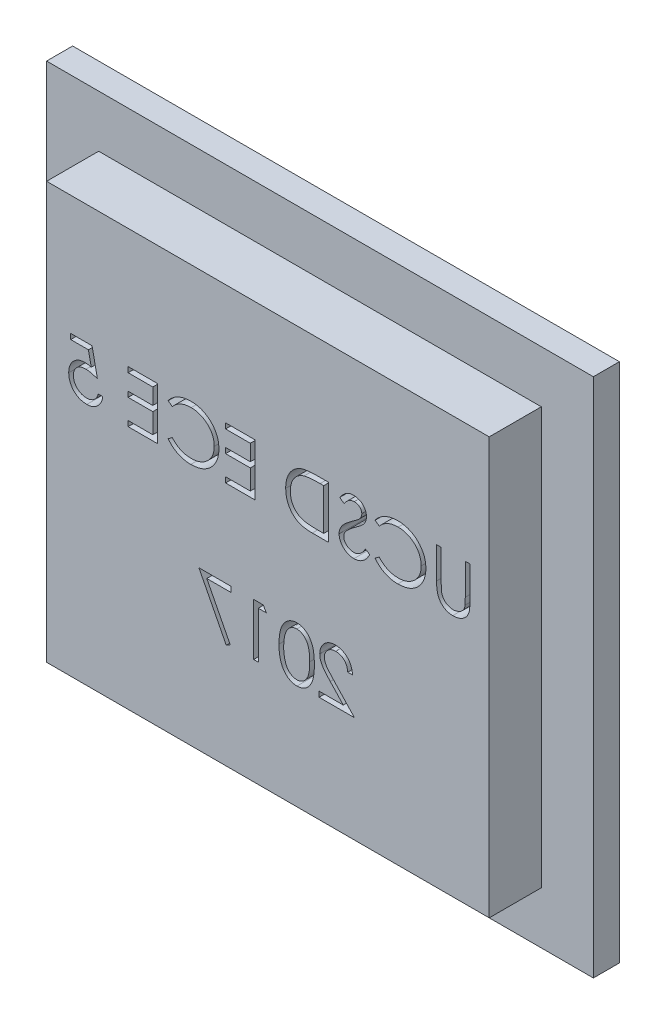
from build123d import *

# Parameters (mm, degrees)
SKETCH1_W               = 10.5
SKETCH1_H               = 10
BOSS_EXTRUDE1_DEPTH     = 0.5
SKETCH2_W               = 8.5
SKETCH2_H               = 8
BOSS_EXTRUDE2_DEPTH     = 1
CUT_EXTRUDE1_DEPTH      = 8.403546447
CUT_EXTRUDE1_DEPTH_BACK = 8.403546447


with BuildPart() as part:
    # Sketch1 → Boss-Extrude1 (new body)
    with BuildSketch(Plane.XY):
        Rectangle(SKETCH1_W, SKETCH1_H)
    extrude(amount=BOSS_EXTRUDE1_DEPTH)

    # Sketch2 → Boss-Extrude2 (add)
    with BuildSketch(Plane.XY.offset(0.5)):
        Rectangle(SKETCH2_W, SKETCH2_H)
    extrude(amount=BOSS_EXTRUDE2_DEPTH)

    # Sketch3 → Cut-Extrude1 (cut, two sides: drawn at the far end of the back side and taken through both)
    # profile 1 of 12: a face of its own
    with BuildSketch(Plane(origin=(0, 0, 0), x_dir=(-1, 0, 0), z_dir=(0, 0, -1)).offset(-CUT_EXTRUDE1_DEPTH_BACK)):
        with BuildLine():
            Line((-3.879763508, 1.701817293), (-3.790019919, 1.701817293))
            Line((-3.790019919, 1.701817293), (-3.790019919, 1.102658639))
            add(Edge.make_bspline(
                [(-3.790019919, 1.102658639), (-3.790033274, 1.094178429), (-3.790058618, 1.078085769), (-3.789889329, 1.05518054), (-3.789415223, 1.03481698), (-3.789116321, 1.016916595), (-3.788451368, 1.001561524), (-3.787909069, 0.988668578), (-3.787211767, 0.978298806), (-3.786373734, 0.972247113), (-3.786013508, 0.969645819)],
                knots=[0, 0, 0, 0, 1.528628734, 2.90083645, 4.128790002, 5.200304208, 6.127813768, 6.898992206, 7.526736466, 8, 8, 8, 8], degree=3))
            add(Edge.make_bspline(
                [(-3.786013508, 0.969645819), (-3.784534234, 0.960261029), (-3.781659038, 0.942020249), (-3.774331502, 0.916046454), (-3.76409793, 0.892637466), (-3.751971347, 0.871062812), (-3.7359906, 0.851922995), (-3.716846733, 0.834291094), (-3.693653085, 0.818870578), (-3.667864341, 0.804770346), (-3.640068558, 0.793437466), (-3.611665339, 0.784867933), (-3.583081631, 0.77964539), (-3.563945584, 0.779040665), (-3.554442996, 0.77874037)],
                knots=[0, 0, 0, 0, 1.035780045, 2.013197591, 2.933192213, 3.817615948, 4.702609284, 5.640816605, 6.646850145, 7.73207398, 8.84249596, 9.914020372, 10.964143139, 12, 12, 12, 12], degree=3))
            add(Edge.make_bspline(
                [(-3.554442996, 0.77874037), (-3.546284784, 0.779047184), (-3.530015481, 0.779659041), (-3.505842215, 0.783448021), (-3.482299327, 0.790276754), (-3.459270561, 0.799088114), (-3.437684565, 0.810730283), (-3.417529296, 0.824179094), (-3.399539601, 0.83995363), (-3.38312303, 0.857410871), (-3.368827334, 0.877107957), (-3.356435579, 0.898615996), (-3.346285314, 0.922258667), (-3.341272878, 0.938874216), (-3.338697803, 0.947410242)],
                knots=[0, 0, 0, 0, 0.994687771, 1.983630487, 2.973142513, 3.978332533, 4.983357753, 5.956394766, 6.925816176, 7.893390482, 8.871859704, 9.88551698, 10.913711441, 12, 12, 12, 12], degree=3))
            add(Edge.make_bspline(
                [(-3.338697803, 0.947410242), (-3.337840625, 0.950938406), (-3.335930485, 0.958800577), (-3.334145615, 0.972092374), (-3.332286608, 0.98777505), (-3.330996731, 1.005961282), (-3.329739239, 1.026590131), (-3.328986933, 1.049769062), (-3.328639209, 1.075413908), (-3.328535586, 1.09331024), (-3.328481457, 1.102658639)],
                knots=[0, 0, 0, 0, 0.558680831, 1.244966039, 2.062412453, 2.990489873, 4.051219941, 5.244515665, 6.560634259, 8, 8, 8, 8], degree=3))
            Line((-3.328481457, 1.102658639), (-3.328481457, 1.701817293))
            Line((-3.328481457, 1.701817293), (-3.238737867, 1.701817293))
            Line((-3.238737867, 1.701817293), (-3.238737867, 1.097850947))
            add(Edge.make_bspline(
                [(-3.238737867, 1.097850947), (-3.238810473, 1.086965696), (-3.238952168, 1.065722466), (-3.240180904, 1.034593507), (-3.242140047, 1.005064083), (-3.244908072, 0.977130227), (-3.248575787, 0.950891896), (-3.252654422, 0.926119105), (-3.257848574, 0.902989679), (-3.26391526, 0.881323273), (-3.270850559, 0.860698841), (-3.279833745, 0.841124951), (-3.28995503, 0.822006551), (-3.301959217, 0.803632806), (-3.315448183, 0.785922362), (-3.330720092, 0.768982626), (-3.347269852, 0.752542899), (-3.365372584, 0.73702488), (-3.384729877, 0.722793829), (-3.40528415, 0.710280181), (-3.426877513, 0.699702004), (-3.449453835, 0.690994597), (-3.47302275, 0.684447569), (-3.497584853, 0.679568953), (-3.523196051, 0.676796868), (-3.540614524, 0.676384888), (-3.549434983, 0.676176267)],
                knots=[0, 0, 0, 0, 1.316592851, 2.569410997, 3.76748051, 4.895814652, 5.963796859, 6.97159953, 7.931736103, 8.829262218, 9.692595152, 10.560224239, 11.431080259, 12.30701507, 13.211635791, 14.121146779, 15.063487852, 16.031507147, 17.00238618, 17.966455255, 18.938106653, 19.907068911, 20.888905087, 21.893141452, 22.933117798, 24, 24, 24, 24], degree=3))
            add(Edge.make_bspline(
                [(-3.549434983, 0.676176267), (-3.559054726, 0.676400486), (-3.577928629, 0.676840402), (-3.605739505, 0.679361188), (-3.632400704, 0.684109301), (-3.658193812, 0.690154999), (-3.682767668, 0.698493209), (-3.70645151, 0.708235531), (-3.728839704, 0.720200462), (-3.750295455, 0.73351286), (-3.770245385, 0.748491328), (-3.788558929, 0.764817092), (-3.805266321, 0.782228629), (-3.820085948, 0.800914447), (-3.833263344, 0.820729221), (-3.844614833, 0.841729004), (-3.854361475, 0.863905665), (-3.859391922, 0.879320866), (-3.861934983, 0.887113767)],
                knots=[0, 0, 0, 0, 1.13879206, 2.234305948, 3.301075583, 4.341971843, 5.366689343, 6.369221514, 7.369726634, 8.367512178, 9.355451585, 10.318319045, 11.268648973, 12.207971039, 13.137398894, 14.081662264, 15.030215811, 16, 16, 16, 16], degree=3))
            add(Edge.make_bspline(
                [(-3.861934983, 0.887113767), (-3.863414171, 0.89243736), (-3.866622563, 0.903984351), (-3.870058362, 0.923094776), (-3.872946671, 0.945099039), (-3.875662545, 0.969998644), (-3.877265104, 0.997812891), (-3.878670087, 1.028529725), (-3.879773406, 1.062186285), (-3.8797669, 1.085630432), (-3.879763508, 1.097850947)],
                knots=[0, 0, 0, 0, 0.625038921, 1.35572334, 2.194682327, 3.136881307, 4.189498639, 5.346923369, 6.617055217, 8, 8, 8, 8], degree=3))
            Line((-3.879763508, 1.097850947), (-3.879763508, 1.701817293))
        make_face()
    # profile 2 of 12: a face of its own
    with BuildSketch(Plane(origin=(0, 0, 0), x_dir=(-1, 0, 0), z_dir=(0, 0, -1)).offset(-CUT_EXTRUDE1_DEPTH_BACK)):
        with BuildLine():
            Line((-2.059250688, 1.518323703), (-2.137776329, 1.458227549))
            add(Edge.make_bspline(
                [(-2.137776329, 1.458227549), (-2.143378011, 1.464903541), (-2.154505853, 1.478165517), (-2.172408483, 1.496788244), (-2.191066095, 1.514235461), (-2.210471558, 1.530590284), (-2.230974164, 1.545280788), (-2.252077249, 1.559072532), (-2.274133833, 1.571434743), (-2.304634329, 1.586424168), (-2.344533714, 1.602065926), (-2.394760811, 1.615181135), (-2.447192553, 1.623530042), (-2.482963296, 1.624434283), (-2.501157739, 1.624894216)],
                knots=[0, 0, 0, 0, 0.757959112, 1.505699292, 2.245454638, 2.979532153, 3.711538275, 4.438200793, 5.171680507, 5.909471876, 7.393775596, 8.890124382, 10.418191784, 12, 12, 12, 12], degree=3))
            add(Edge.make_bspline(
                [(-2.501157739, 1.624894216), (-2.511181539, 1.624778798), (-2.531136108, 1.624549034), (-2.560749958, 1.621517855), (-2.58981083, 1.617257509), (-2.61829982, 1.610935988), (-2.646180665, 1.602943811), (-2.673635637, 1.593393693), (-2.700267237, 1.581578025), (-2.726443877, 1.568518522), (-2.751523651, 1.553767823), (-2.775253665, 1.537678294), (-2.79754737, 1.520429981), (-2.818422402, 1.501958236), (-2.837900102, 1.482346248), (-2.855839333, 1.461385007), (-2.872178022, 1.439141529), (-2.887240029, 1.415909127), (-2.900729381, 1.391755472), (-2.912023633, 1.366591166), (-2.922025096, 1.340847137), (-2.929939166, 1.314232519), (-2.936203313, 1.286934586), (-2.940525503, 1.258880075), (-2.943522209, 1.230127596), (-2.943750831, 1.210639221), (-2.943866073, 1.20081569)],
                knots=[0, 0, 0, 0, 1.054917814, 2.100044995, 3.131103042, 4.146048494, 5.169673617, 6.183595914, 7.203665975, 8.234915748, 9.262203917, 10.264457458, 11.251630812, 12.227803204, 13.197192746, 14.159520551, 15.12972552, 16.100847026, 17.073214652, 18.039054194, 19.002613845, 19.979014051, 20.95965708, 21.949030935, 22.966165397, 24, 24, 24, 24], degree=3))
            add(Edge.make_bspline(
                [(-2.943866073, 1.20081569), (-2.943505553, 1.186035313), (-2.94279772, 1.157016003), (-2.936498196, 1.114510115), (-2.926925313, 1.073789922), (-2.912578005, 1.035109967), (-2.894886848, 0.997993293), (-2.872532387, 0.963067907), (-2.846641948, 0.929806031), (-2.816849257, 0.89899376), (-2.784161881, 0.870846982), (-2.749091049, 0.846061101), (-2.71172411, 0.825399706), (-2.672473644, 0.808206579), (-2.631037611, 0.794990371), (-2.587490525, 0.785686335), (-2.541927098, 0.779617141), (-2.510792983, 0.779036087), (-2.494947803, 0.77874037)],
                knots=[0, 0, 0, 0, 1.029171465, 2.020641659, 2.987623507, 3.938342917, 4.889210282, 5.84687017, 6.821220943, 7.821438502, 8.827599549, 9.822697543, 10.807740252, 11.797342354, 12.80366471, 13.83203677, 14.896651826, 16, 16, 16, 16], degree=3))
            add(Edge.make_bspline(
                [(-2.494947803, 0.77874037), (-2.477489892, 0.779222878), (-2.443128547, 0.78017257), (-2.392737682, 0.78821807), (-2.344498892, 0.80126319), (-2.298409581, 0.819519739), (-2.254599683, 0.843252678), (-2.213000637, 0.8720235), (-2.173577331, 0.906105881), (-2.14987125, 0.932129632), (-2.137776329, 0.945407036)],
                knots=[0, 0, 0, 0, 1.028121516, 2.023589091, 2.998037872, 3.967518031, 4.937445131, 5.927275754, 6.942489185, 8, 8, 8, 8], degree=3))
            Line((-2.137776329, 0.945407036), (-2.059250688, 0.885911844))
            add(Edge.make_bspline(
                [(-2.059250688, 0.885911844), (-2.065570148, 0.877758001), (-2.078178798, 0.86148937), (-2.098595374, 0.838554596), (-2.120103173, 0.816982015), (-2.142861948, 0.796945551), (-2.166609888, 0.778044276), (-2.191773406, 0.760815181), (-2.218021701, 0.745017785), (-2.245265838, 0.73055295), (-2.27347687, 0.717719451), (-2.302620994, 0.70673266), (-2.332572587, 0.697268406), (-2.363333018, 0.689482138), (-2.394966092, 0.683404686), (-2.427357656, 0.679341921), (-2.46057762, 0.676558517), (-2.482989455, 0.676304827), (-2.494346842, 0.676176267)],
                knots=[0, 0, 0, 0, 0.986787822, 1.968848986, 2.935600012, 3.899624008, 4.868462664, 5.837806735, 6.815139263, 7.798259679, 8.787526145, 9.778297419, 10.776456485, 11.791383307, 12.812564526, 13.85620153, 14.913611965, 16, 16, 16, 16], degree=3))
            add(Edge.make_bspline(
                [(-2.494346842, 0.676176267), (-2.505102175, 0.676251122), (-2.526369515, 0.676399139), (-2.557769159, 0.678796901), (-2.58833761, 0.682068254), (-2.617987503, 0.686994006), (-2.646880639, 0.692806675), (-2.674755092, 0.700598462), (-2.701885152, 0.709326796), (-2.728161821, 0.719585363), (-2.753607449, 0.731161415), (-2.778139967, 0.744244718), (-2.80174809, 0.758725251), (-2.824663925, 0.774283825), (-2.846548949, 0.791420197), (-2.867592813, 0.809896378), (-2.887913521, 0.829650096), (-2.900485716, 0.843894339), (-2.906806778, 0.851056075)],
                knots=[0, 0, 0, 0, 1.114604814, 2.203992996, 3.262667896, 4.300477797, 5.318619304, 6.316056647, 7.298880507, 8.271930387, 9.238335007, 10.195173496, 11.151986948, 12.108099108, 13.064862484, 14.031167946, 15.010108607, 16, 16, 16, 16], degree=3))
            add(Edge.make_bspline(
                [(-2.906806778, 0.851056075), (-2.916931247, 0.863496415), (-2.937057955, 0.888226903), (-2.96280815, 0.928308612), (-2.984850309, 0.970156672), (-3.002672, 1.013990937), (-3.01660421, 1.059713048), (-3.02625598, 1.107346052), (-3.032527867, 1.156845464), (-3.033245092, 1.190513118), (-3.033609662, 1.207626588)],
                knots=[0, 0, 0, 0, 0.994628077, 1.977248131, 2.950237994, 3.925870899, 4.908910175, 5.911660606, 6.938484602, 8, 8, 8, 8], degree=3))
            add(Edge.make_bspline(
                [(-3.033609662, 1.207626588), (-3.033165321, 1.22561386), (-3.032291108, 1.261002696), (-3.024863738, 1.312938111), (-3.01291551, 1.362695654), (-2.995944971, 1.410182438), (-2.974429156, 1.455648232), (-2.947850124, 1.498745719), (-2.916516654, 1.539750519), (-2.880674492, 1.578040448), (-2.841369539, 1.613051692), (-2.79927845, 1.643853464), (-2.754483608, 1.66948704), (-2.707478507, 1.690914515), (-2.65791117, 1.707384362), (-2.60588735, 1.718913844), (-2.551504803, 1.726090163), (-2.514401253, 1.726997365), (-2.495548765, 1.727458319)],
                knots=[0, 0, 0, 0, 1.032925535, 2.032216505, 3.007276963, 3.968222605, 4.92396291, 5.891752235, 6.871517503, 7.883894988, 8.900124299, 9.891468569, 10.874487609, 11.85992873, 12.854644235, 13.869047385, 14.917252991, 16, 16, 16, 16], degree=3))
            add(Edge.make_bspline(
                [(-2.495548765, 1.727458319), (-2.484058916, 1.727320565), (-2.461315916, 1.727047895), (-2.427672301, 1.724388997), (-2.394917351, 1.719956538), (-2.363028499, 1.713923376), (-2.331850609, 1.706435569), (-2.301621968, 1.696681199), (-2.272165201, 1.685527904), (-2.243666084, 1.672682628), (-2.216261355, 1.658263559), (-2.18995955, 1.642430524), (-2.16496959, 1.625203151), (-2.141115634, 1.606727958), (-2.118796716, 1.586614084), (-2.097379151, 1.56541477), (-2.077590272, 1.542519392), (-2.065375073, 1.526403697), (-2.059250688, 1.518323703)],
                knots=[0, 0, 0, 0, 1.096760587, 2.17092713, 3.219439832, 4.250915756, 5.268269357, 6.278326846, 7.281116186, 8.274029601, 9.260640565, 10.235837813, 11.203064059, 12.156899882, 13.114053108, 14.069676657, 15.032185724, 16, 16, 16, 16], degree=3))
        make_face()
    # profile 3 of 12: a face of its own
    with BuildSketch(Plane(origin=(0, 0, 0), x_dir=(-1, 0, 0), z_dir=(0, 0, -1)).offset(-CUT_EXTRUDE1_DEPTH_BACK)):
        with BuildLine():
            Line((-1.956686585, 0.894725947), (-1.872151329, 0.945407036))
            add(Edge.make_bspline(
                [(-1.872151329, 0.945407036), (-1.864288975, 0.932245784), (-1.84922501, 0.907029331), (-1.82409605, 0.872955605), (-1.798058075, 0.843994989), (-1.770918266, 0.820315958), (-1.74284228, 0.801673419), (-1.713646836, 0.788472782), (-1.683430319, 0.780239646), (-1.66286637, 0.779239621), (-1.652600047, 0.77874037)],
                knots=[0, 0, 0, 0, 1.272034388, 2.437168799, 3.508375237, 4.49857839, 5.41946034, 6.295179144, 7.148887113, 8, 8, 8, 8], degree=3))
            add(Edge.make_bspline(
                [(-1.652600047, 0.77874037), (-1.643832372, 0.778984562), (-1.626450437, 0.779468673), (-1.600861225, 0.784120331), (-1.576009281, 0.791266654), (-1.552406814, 0.801501206), (-1.530379495, 0.81388363), (-1.511063296, 0.828839681), (-1.494364407, 0.845584311), (-1.48070466, 0.864265069), (-1.47022465, 0.884355683), (-1.462169773, 0.904977384), (-1.457699752, 0.926454118), (-1.457026394, 0.94091425), (-1.456686585, 0.948211524)],
                knots=[0, 0, 0, 0, 1.095163259, 2.171163733, 3.241058638, 4.321873601, 5.38011039, 6.391990106, 7.366004449, 8.327778327, 9.272591725, 10.192022065, 11.087607919, 12, 12, 12, 12], degree=3))
            add(Edge.make_bspline(
                [(-1.456686585, 0.948211524), (-1.457107817, 0.956537481), (-1.457964119, 0.973462935), (-1.465201685, 0.998434264), (-1.476587184, 1.023146427), (-1.487090797, 1.038432503), (-1.492543957, 1.046368575)],
                knots=[0, 0, 0, 0, 0.938893495, 1.908633276, 2.914225137, 4, 4, 4, 4], degree=3))
            add(Edge.make_bspline(
                [(-1.492543957, 1.046368575), (-1.497021275, 1.052096239), (-1.506420845, 1.064120753), (-1.522580135, 1.082019391), (-1.541541882, 1.100481797), (-1.562657183, 1.120212956), (-1.586695208, 1.140295184), (-1.61290307, 1.16168612), (-1.641949886, 1.183572285), (-1.662321171, 1.198250161), (-1.672832419, 1.205823703)],
                knots=[0, 0, 0, 0, 0.722233717, 1.516239348, 2.393582979, 3.351407094, 4.387010283, 5.505090956, 6.712668013, 8, 8, 8, 8], degree=3))
            add(Edge.make_bspline(
                [(-1.672832419, 1.205823703), (-1.68335356, 1.213317585), (-1.703469182, 1.227645317), (-1.731600206, 1.248909399), (-1.756755767, 1.268350504), (-1.778824057, 1.28615165), (-1.797795371, 1.302315252), (-1.813819202, 1.316686092), (-1.826487361, 1.329652823), (-1.833531813, 1.338064635), (-1.836694598, 1.341841331)],
                knots=[0, 0, 0, 0, 1.452282411, 2.77665338, 3.964542531, 5.026858415, 5.96415736, 6.766646006, 7.446254459, 8, 8, 8, 8], degree=3))
            add(Edge.make_bspline(
                [(-1.836694598, 1.341841331), (-1.841115325, 1.347727342), (-1.849809279, 1.359302972), (-1.86128528, 1.377395788), (-1.871039327, 1.395916721), (-1.878685707, 1.414915539), (-1.885124627, 1.434125519), (-1.889455464, 1.453797304), (-1.892167292, 1.473842623), (-1.892445003, 1.487332195), (-1.892584021, 1.494084921)],
                knots=[0, 0, 0, 0, 1.068054152, 2.10047183, 3.106115577, 4.101338837, 5.06977816, 6.043150881, 7.020423561, 8, 8, 8, 8], degree=3))
            add(Edge.make_bspline(
                [(-1.892584021, 1.494084921), (-1.892211104, 1.504664857), (-1.891473241, 1.525598589), (-1.885233094, 1.556178826), (-1.875383696, 1.585374946), (-1.861585156, 1.612897898), (-1.843797341, 1.638031036), (-1.823212777, 1.66106346), (-1.798695209, 1.680425912), (-1.77179446, 1.697343643), (-1.742349782, 1.710585336), (-1.711495238, 1.720574188), (-1.679181789, 1.726233976), (-1.657295179, 1.727046194), (-1.64618979, 1.727458319)],
                knots=[0, 0, 0, 0, 1.005424448, 1.989358655, 2.955360095, 3.929531133, 4.905563448, 5.876582895, 6.856512386, 7.866279853, 8.892233794, 9.918561126, 10.94386622, 12, 12, 12, 12], degree=3))
            add(Edge.make_bspline(
                [(-1.64618979, 1.727458319), (-1.634405762, 1.727051875), (-1.61097109, 1.726243589), (-1.576499885, 1.719215723), (-1.543311109, 1.70758696), (-1.516613034, 1.6943902), (-1.495717959, 1.681209796), (-1.479782892, 1.669204132), (-1.463635049, 1.655382672), (-1.447144177, 1.639708602), (-1.430589702, 1.622038102), (-1.413725859, 1.60249219), (-1.396513211, 1.581190317), (-1.385440108, 1.565983317), (-1.379763508, 1.558187485)],
                knots=[0, 0, 0, 0, 1.286793592, 2.559021753, 3.825965368, 5.121522368, 5.803751409, 6.523245864, 7.299691795, 8.125521123, 9.008227632, 9.944561021, 10.946284179, 12, 12, 12, 12], degree=3))
            Line((-1.379763508, 1.558187485), (-1.460893316, 1.496689088))
            add(Edge.make_bspline(
                [(-1.460893316, 1.496689088), (-1.465792154, 1.503000142), (-1.47522617, 1.515153757), (-1.489548881, 1.532174133), (-1.503048494, 1.547721699), (-1.516348609, 1.561226021), (-1.528746789, 1.573426631), (-1.54078023, 1.583872275), (-1.552275759, 1.592665303), (-1.566766305, 1.602049177), (-1.584971367, 1.611351035), (-1.607824092, 1.6192222), (-1.631705884, 1.623952218), (-1.647971493, 1.624577614), (-1.656205816, 1.624894216)],
                knots=[0, 0, 0, 0, 1.181633172, 2.275549214, 3.290209073, 4.226197932, 5.078386478, 5.862611352, 6.581680152, 7.217281963, 8.414376989, 9.595101626, 10.782541182, 12, 12, 12, 12], degree=3))
            add(Edge.make_bspline(
                [(-1.656205816, 1.624894216), (-1.666536251, 1.624548016), (-1.686457522, 1.623880402), (-1.714740446, 1.616588978), (-1.740195854, 1.605108446), (-1.762068015, 1.589018452), (-1.78027858, 1.569955312), (-1.793451568, 1.548018496), (-1.801380186, 1.523794952), (-1.802347695, 1.506897336), (-1.802840431, 1.498291652)],
                knots=[0, 0, 0, 0, 1.14458467, 2.207223713, 3.21896685, 4.227309161, 5.202851033, 6.127160689, 7.046193047, 8, 8, 8, 8], degree=3))
            add(Edge.make_bspline(
                [(-1.802840431, 1.498291652), (-1.80272811, 1.492934087), (-1.802503282, 1.482210195), (-1.799367626, 1.466366932), (-1.795339246, 1.450563692), (-1.788955637, 1.434871526), (-1.780142693, 1.419015994), (-1.768569786, 1.402724069), (-1.753994554, 1.385852153), (-1.742829693, 1.374878617), (-1.736934983, 1.369084921)],
                knots=[0, 0, 0, 0, 0.858281714, 1.717966888, 2.583508476, 3.4729293, 4.427298488, 5.488583878, 6.674047936, 8, 8, 8, 8], degree=3))
            add(Edge.make_bspline(
                [(-1.736934983, 1.369084921), (-1.734746019, 1.367131485), (-1.729545543, 1.362490569), (-1.720038136, 1.354892774), (-1.70748305, 1.345520553), (-1.692208136, 1.333924177), (-1.673931747, 1.320472331), (-1.652651873, 1.305337013), (-1.628605721, 1.288026882), (-1.611542317, 1.275924728), (-1.602519919, 1.269525626)],
                knots=[0, 0, 0, 0, 0.420754252, 0.999615792, 1.744751191, 2.668019286, 3.750313428, 4.999500688, 6.413464383, 8, 8, 8, 8], degree=3))
            add(Edge.make_bspline(
                [(-1.602519919, 1.269525626), (-1.591666801, 1.261628095), (-1.570651242, 1.24633562), (-1.540749076, 1.223359712), (-1.513636559, 1.200888921), (-1.489218501, 1.179066747), (-1.46725367, 1.158058721), (-1.44798575, 1.137612098), (-1.431218413, 1.117873363), (-1.413167207, 1.092566912), (-1.394722116, 1.061486603), (-1.378881685, 1.023407106), (-1.368893586, 0.985179586), (-1.367587439, 0.959486204), (-1.366942996, 0.94680928)],
                knots=[0, 0, 0, 0, 1.163667725, 2.253281268, 3.268753668, 4.215851969, 5.092017293, 5.902905408, 6.650798638, 7.335211899, 8.59617414, 9.77448103, 10.901945474, 12, 12, 12, 12], degree=3))
            add(Edge.make_bspline(
                [(-1.366942996, 0.94680928), (-1.367130749, 0.937844033), (-1.367502611, 0.920087638), (-1.371777158, 0.894014759), (-1.378039919, 0.868691653), (-1.387479129, 0.844431335), (-1.399000031, 0.820789974), (-1.413618959, 0.798387717), (-1.430564012, 0.776728746), (-1.45000223, 0.756390606), (-1.471272488, 0.737720264), (-1.493753544, 0.721111961), (-1.517482193, 0.707263868), (-1.542329712, 0.695963628), (-1.568301808, 0.68712548), (-1.595389747, 0.680721803), (-1.623638178, 0.6767916), (-1.642838316, 0.676383668), (-1.652600047, 0.676176267)],
                knots=[0, 0, 0, 0, 0.983748083, 1.948392443, 2.894712957, 3.844097841, 4.80183111, 5.778335162, 6.776009319, 7.81870978, 8.863265674, 9.881300176, 10.883814829, 11.87499822, 12.874611388, 13.892143829, 14.928324115, 16, 16, 16, 16], degree=3))
            add(Edge.make_bspline(
                [(-1.652600047, 0.676176267), (-1.660153002, 0.676322319), (-1.675163791, 0.676612584), (-1.6973665, 0.679178664), (-1.719120668, 0.682809265), (-1.74015332, 0.688573285), (-1.760735438, 0.695566707), (-1.780777505, 0.704177659), (-1.800289234, 0.714496859), (-1.819379972, 0.726295438), (-1.838001165, 0.740026222), (-1.855978156, 0.756018649), (-1.87390078, 0.773831651), (-1.891240036, 0.793948955), (-1.908346649, 0.81604555), (-1.924883337, 0.840328174), (-1.9411924, 0.86666456), (-1.95142539, 0.885197442), (-1.956686585, 0.894725947)],
                knots=[0, 0, 0, 0, 0.915332311, 1.819136955, 2.706846663, 3.586547465, 4.459518054, 5.340707479, 6.227863349, 7.133153174, 8.059268498, 9.028702269, 10.047606654, 11.120612155, 12.245963614, 13.433783089, 14.680604001, 16, 16, 16, 16], degree=3))
        make_face()
    # profile 4 of 12: a face of its own
    with BuildSketch(Plane(origin=(0, 0, 0), x_dir=(-1, 0, 0), z_dir=(0, 0, -1)).offset(-CUT_EXTRUDE1_DEPTH_BACK)):
        with BuildLine():
            Line((-1.16181479, 0.701817293), (-1.16181479, 1.701817293))
            Line((-1.16181479, 1.701817293), (-0.959891714, 1.701817293))
            add(Edge.make_bspline(
                [(-0.959891714, 1.701817293), (-0.942329145, 1.701690844), (-0.908398355, 1.701446546), (-0.859366228, 1.699897577), (-0.813999438, 1.697157444), (-0.772447193, 1.693166151), (-0.734595418, 1.688265284), (-0.700550101, 1.682122312), (-0.670135203, 1.674868549), (-0.651429649, 1.668684134), (-0.642584021, 1.665759601)],
                knots=[0, 0, 0, 0, 1.314313732, 2.53924729, 3.670748893, 4.714932338, 5.66265055, 6.526160246, 7.303039223, 8, 8, 8, 8], degree=3))
            add(Edge.make_bspline(
                [(-0.642584021, 1.665759601), (-0.631014096, 1.661350828), (-0.608136612, 1.652633258), (-0.575563149, 1.6361886), (-0.544898759, 1.617556286), (-0.515979004, 1.596711753), (-0.489464482, 1.573064797), (-0.464319368, 1.547619915), (-0.441572304, 1.519451818), (-0.420741363, 1.489144678), (-0.401959746, 1.457055521), (-0.385634272, 1.42324549), (-0.372075988, 1.387886287), (-0.360820781, 1.351076245), (-0.351950364, 1.312734423), (-0.345898384, 1.272816175), (-0.341906672, 1.231479264), (-0.341505515, 1.203429417), (-0.34130197, 1.189197101)],
                knots=[0, 0, 0, 0, 0.984719456, 1.947108742, 2.898477687, 3.838006223, 4.779231079, 5.722358779, 6.681677486, 7.655904652, 8.64651281, 9.637519902, 10.640069247, 11.656948941, 12.698408672, 13.768548281, 14.867775369, 16, 16, 16, 16], degree=3))
            add(Edge.make_bspline(
                [(-0.34130197, 1.189197101), (-0.341481675, 1.176836747), (-0.341835802, 1.152479378), (-0.345015607, 1.11658198), (-0.349637413, 1.081749531), (-0.356792898, 1.048147902), (-0.36547933, 1.015482697), (-0.376611945, 0.984102056), (-0.389364944, 0.95371811), (-0.404236338, 0.924741689), (-0.420562448, 0.897289297), (-0.438082946, 0.871410574), (-0.456779144, 0.847474797), (-0.476829325, 0.825409479), (-0.497974387, 0.805247885), (-0.520352767, 0.786821595), (-0.54402221, 0.770491151), (-0.568876702, 0.755614834), (-0.595641311, 0.74263759), (-0.624822987, 0.731657587), (-0.656546181, 0.722558554), (-0.690733025, 0.714966869), (-0.72744259, 0.708944783), (-0.766710866, 0.704908671), (-0.808477521, 0.702179261), (-0.837157311, 0.701940292), (-0.851918957, 0.701817293)],
                knots=[0, 0, 0, 0, 1.105936401, 2.179363191, 3.223086493, 4.248585256, 5.251745608, 6.245858792, 7.225916811, 8.198733463, 9.158002045, 10.082870192, 10.993790845, 11.873723703, 12.748670949, 13.606408763, 14.465103618, 15.319838547, 16.196477973, 17.123216899, 18.106603292, 19.147568657, 20.255746949, 21.433717677, 22.679120308, 24, 24, 24, 24], degree=3))
            Line((-0.851918957, 0.701817293), (-1.16181479, 0.701817293))
        make_face()
        with BuildLine():
            Line((-1.072071201, 0.804381395), (-0.957287547, 0.804381395))
            add(Edge.make_bspline(
                [(-0.957287547, 0.804381395), (-0.940793727, 0.80445228), (-0.90907007, 0.804588617), (-0.863453499, 0.805784961), (-0.821773672, 0.8077398), (-0.784024669, 0.810475537), (-0.750227805, 0.814095141), (-0.720312448, 0.818130828), (-0.69437666, 0.823158671), (-0.678682535, 0.827716088), (-0.671430175, 0.829822101)],
                knots=[0, 0, 0, 0, 1.375205317, 2.645023457, 3.804390687, 4.853969522, 5.800190428, 6.637939096, 7.370582563, 8, 8, 8, 8], degree=3))
            add(Edge.make_bspline(
                [(-0.671430175, 0.829822101), (-0.662302072, 0.833036832), (-0.644263889, 0.83938951), (-0.618297865, 0.850977413), (-0.594081578, 0.864703718), (-0.571192999, 0.879961511), (-0.549956812, 0.89728894), (-0.53012135, 0.916309223), (-0.51172655, 0.937119158), (-0.494962462, 0.959692919), (-0.479960089, 0.983890003), (-0.466968309, 1.009472527), (-0.455582157, 1.036160187), (-0.446645417, 1.064362804), (-0.439640964, 1.093828249), (-0.434679625, 1.124558596), (-0.431589703, 1.156548105), (-0.43122929, 1.178305855), (-0.43104556, 1.189397421)],
                knots=[0, 0, 0, 0, 0.998632004, 1.973411704, 2.929992603, 3.868527914, 4.809262121, 5.754881198, 6.702106254, 7.672490631, 8.653608572, 9.636854334, 10.631411391, 11.644891563, 12.686317036, 13.754757253, 14.855430412, 16, 16, 16, 16], degree=3))
            add(Edge.make_bspline(
                [(-0.43104556, 1.189397421), (-0.431192213, 1.201092701), (-0.431480315, 1.224068182), (-0.435101547, 1.25777981), (-0.44039342, 1.290202853), (-0.448045902, 1.32133948), (-0.457797581, 1.351250438), (-0.469967479, 1.379770298), (-0.483872227, 1.40720026), (-0.500416038, 1.432907222), (-0.518534779, 1.457219539), (-0.538642744, 1.479492372), (-0.56042047, 1.499776458), (-0.583630427, 1.51838769), (-0.608926741, 1.534577312), (-0.635713509, 1.54905922), (-0.664383701, 1.561349475), (-0.684330186, 1.567886293), (-0.694467034, 1.571208319)],
                knots=[0, 0, 0, 0, 1.122418816, 2.205001699, 3.251619955, 4.274784885, 5.280384055, 6.268708349, 7.249350384, 8.229342522, 9.199999885, 10.157847722, 11.105861043, 12.055065948, 13.010012805, 13.98527497, 14.976112212, 16, 16, 16, 16], degree=3))
            add(Edge.make_bspline(
                [(-0.694467034, 1.571208319), (-0.702853076, 1.573527298), (-0.720684102, 1.578458084), (-0.749781091, 1.583836762), (-0.782528277, 1.588580905), (-0.819071049, 1.592597487), (-0.859367751, 1.595479579), (-0.903449376, 1.597642812), (-0.951334978, 1.59910185), (-0.984529987, 1.599201481), (-1.001758701, 1.59925319)],
                knots=[0, 0, 0, 0, 0.674548936, 1.434276114, 2.292660221, 3.240891867, 4.284742987, 5.42552168, 6.663806718, 8, 8, 8, 8], degree=3))
            Line((-1.001758701, 1.59925319), (-1.072071201, 1.59925319))
            Line((-1.072071201, 1.59925319), (-1.072071201, 0.804381395))
        make_face(mode=Mode.SUBTRACT)
    # profile 5 of 12: a face of its own
    with BuildSketch(Plane(origin=(0, 0, 0), x_dir=(-1, 0, 0), z_dir=(0, 0, -1)).offset(-CUT_EXTRUDE1_DEPTH_BACK)):
        Polygon((0.24844162, 1.701817293), (0.812544184, 1.701817293), (0.812544184, 1.59925319), (0.33818521, 1.59925319), (0.33818521, 1.291560883), (0.812544184, 1.291560883), (0.812544184, 1.18899678), (0.33818521, 1.18899678), (0.33818521, 0.804381395), (0.812544184, 0.804381395), (0.812544184, 0.701817293), (0.24844162, 0.701817293), align=None)
    # profile 6 of 12: a face of its own
    with BuildSketch(Plane(origin=(0, 0, 0), x_dir=(-1, 0, 0), z_dir=(0, 0, -1)).offset(-CUT_EXTRUDE1_DEPTH_BACK)):
        with BuildLine():
            Line((1.915108286, 1.518323703), (1.836582645, 1.458227549))
            add(Edge.make_bspline(
                [(1.836582645, 1.458227549), (1.830980963, 1.464903541), (1.819853121, 1.478165517), (1.801950492, 1.496788244), (1.78329288, 1.514235461), (1.763887416, 1.530590284), (1.743384811, 1.545280788), (1.722281725, 1.559072532), (1.700225141, 1.571434743), (1.669724645, 1.586424168), (1.62982526, 1.602065926), (1.579598163, 1.615181135), (1.527166421, 1.623530042), (1.491395678, 1.624434283), (1.473201235, 1.624894216)],
                knots=[0, 0, 0, 0, 0.757959112, 1.505699292, 2.245454638, 2.979532153, 3.711538275, 4.438200793, 5.171680507, 5.909471876, 7.393775596, 8.890124382, 10.418191784, 12, 12, 12, 12], degree=3))
            add(Edge.make_bspline(
                [(1.473201235, 1.624894216), (1.463177435, 1.624778798), (1.443222866, 1.624549034), (1.413609016, 1.621517855), (1.384548145, 1.617257509), (1.356059154, 1.610935988), (1.328178309, 1.602943811), (1.300723337, 1.593393693), (1.274091737, 1.581578025), (1.247915098, 1.568518522), (1.222835323, 1.553767823), (1.199105309, 1.537678294), (1.176811604, 1.520429981), (1.155936572, 1.501958236), (1.136458873, 1.482346248), (1.118519641, 1.461385007), (1.102180952, 1.439141529), (1.087118945, 1.415909127), (1.073629593, 1.391755472), (1.062335342, 1.366591166), (1.052333878, 1.340847137), (1.044419809, 1.314232519), (1.038155661, 1.286934586), (1.033833472, 1.258880075), (1.030836766, 1.230127596), (1.030608144, 1.210639221), (1.030492902, 1.20081569)],
                knots=[0, 0, 0, 0, 1.054917814, 2.100044995, 3.131103042, 4.146048494, 5.169673617, 6.183595914, 7.203665975, 8.234915748, 9.262203917, 10.264457458, 11.251630812, 12.227803204, 13.197192746, 14.159520551, 15.12972552, 16.100847026, 17.073214652, 18.039054194, 19.002613845, 19.979014051, 20.95965708, 21.949030935, 22.966165397, 24, 24, 24, 24], degree=3))
            add(Edge.make_bspline(
                [(1.030492902, 1.20081569), (1.030853422, 1.186035313), (1.031561254, 1.157016003), (1.037860778, 1.114510115), (1.047433661, 1.073789922), (1.061780969, 1.035109967), (1.079472126, 0.997993293), (1.101826587, 0.963067907), (1.127717026, 0.929806031), (1.157509717, 0.89899376), (1.190197093, 0.870846982), (1.225267925, 0.846061101), (1.262634865, 0.825399706), (1.30188533, 0.808206579), (1.343321363, 0.794990371), (1.386868449, 0.785686335), (1.432431877, 0.779617141), (1.463565991, 0.779036087), (1.479411171, 0.77874037)],
                knots=[0, 0, 0, 0, 1.029171465, 2.020641659, 2.987623507, 3.938342917, 4.889210282, 5.84687017, 6.821220943, 7.821438502, 8.827599549, 9.822697543, 10.807740252, 11.797342354, 12.80366471, 13.83203677, 14.896651826, 16, 16, 16, 16], degree=3))
            add(Edge.make_bspline(
                [(1.479411171, 0.77874037), (1.496869082, 0.779222878), (1.531230428, 0.78017257), (1.581621292, 0.78821807), (1.629860082, 0.80126319), (1.675949393, 0.819519739), (1.719759292, 0.843252678), (1.761358338, 0.8720235), (1.800781643, 0.906105881), (1.824487724, 0.932129632), (1.836582645, 0.945407036)],
                knots=[0, 0, 0, 0, 1.028121516, 2.023589091, 2.998037872, 3.967518031, 4.937445131, 5.927275754, 6.942489185, 8, 8, 8, 8], degree=3))
            Line((1.836582645, 0.945407036), (1.915108286, 0.885911844))
            add(Edge.make_bspline(
                [(1.915108286, 0.885911844), (1.908788827, 0.877758001), (1.896180176, 0.86148937), (1.8757636, 0.838554596), (1.854255801, 0.816982015), (1.831497027, 0.796945551), (1.807749086, 0.778044276), (1.782585568, 0.760815181), (1.756337273, 0.745017785), (1.729093137, 0.73055295), (1.700882104, 0.717719451), (1.67173798, 0.70673266), (1.641786387, 0.697268406), (1.611025956, 0.689482138), (1.579392883, 0.683404686), (1.547001319, 0.679341921), (1.513781354, 0.676558517), (1.49136952, 0.676304827), (1.480012133, 0.676176267)],
                knots=[0, 0, 0, 0, 0.986787822, 1.968848986, 2.935600012, 3.899624008, 4.868462664, 5.837806735, 6.815139263, 7.798259679, 8.787526145, 9.778297419, 10.776456485, 11.791383307, 12.812564526, 13.85620153, 14.913611965, 16, 16, 16, 16], degree=3))
            add(Edge.make_bspline(
                [(1.480012133, 0.676176267), (1.469256799, 0.676251122), (1.447989459, 0.676399139), (1.416589816, 0.678796901), (1.386021364, 0.682068254), (1.356371471, 0.686994006), (1.327478335, 0.692806675), (1.299603883, 0.700598462), (1.272473823, 0.709326796), (1.246197154, 0.719585363), (1.220751525, 0.731161415), (1.196219008, 0.744244718), (1.172610884, 0.758725251), (1.14969505, 0.774283825), (1.127810026, 0.791420197), (1.106766161, 0.809896378), (1.086445454, 0.829650096), (1.073873258, 0.843894339), (1.067552197, 0.851056075)],
                knots=[0, 0, 0, 0, 1.114604814, 2.203992996, 3.262667896, 4.300477797, 5.318619304, 6.316056647, 7.298880507, 8.271930387, 9.238335007, 10.195173496, 11.151986948, 12.108099108, 13.064862484, 14.031167946, 15.010108607, 16, 16, 16, 16], degree=3))
            add(Edge.make_bspline(
                [(1.067552197, 0.851056075), (1.057427727, 0.863496415), (1.037301019, 0.888226903), (1.011550824, 0.928308612), (0.989508666, 0.970156672), (0.971686974, 1.013990937), (0.957754764, 1.059713048), (0.948102994, 1.107346052), (0.941831107, 1.156845464), (0.941113882, 1.190513118), (0.940749312, 1.207626588)],
                knots=[0, 0, 0, 0, 0.994628077, 1.977248131, 2.950237994, 3.925870899, 4.908910175, 5.911660606, 6.938484602, 8, 8, 8, 8], degree=3))
            add(Edge.make_bspline(
                [(0.940749312, 1.207626588), (0.941193653, 1.22561386), (0.942067866, 1.261002696), (0.949495236, 1.312938111), (0.961443464, 1.362695654), (0.978414004, 1.410182438), (0.999929818, 1.455648232), (1.026508851, 1.498745719), (1.05784232, 1.539750519), (1.093684482, 1.578040448), (1.132989435, 1.613051692), (1.175080525, 1.643853464), (1.219875367, 1.66948704), (1.266880467, 1.690914515), (1.316447805, 1.707384362), (1.368471625, 1.718913844), (1.422854172, 1.726090163), (1.459957722, 1.726997365), (1.47881021, 1.727458319)],
                knots=[0, 0, 0, 0, 1.032925535, 2.032216505, 3.007276963, 3.968222605, 4.92396291, 5.891752235, 6.871517503, 7.883894988, 8.900124299, 9.891468569, 10.874487609, 11.85992873, 12.854644235, 13.869047385, 14.917252991, 16, 16, 16, 16], degree=3))
            add(Edge.make_bspline(
                [(1.47881021, 1.727458319), (1.490300059, 1.727320565), (1.513043058, 1.727047895), (1.546686673, 1.724388997), (1.579441623, 1.719956538), (1.611330475, 1.713923376), (1.642508366, 1.706435569), (1.672737006, 1.696681199), (1.702193774, 1.685527904), (1.73069289, 1.672682628), (1.758097619, 1.658263559), (1.784399424, 1.642430524), (1.809389384, 1.625203151), (1.833243341, 1.606727958), (1.855562258, 1.586614084), (1.876979823, 1.56541477), (1.896768703, 1.542519392), (1.908983901, 1.526403697), (1.915108286, 1.518323703)],
                knots=[0, 0, 0, 0, 1.096760587, 2.17092713, 3.219439832, 4.250915756, 5.268269357, 6.278326846, 7.281116186, 8.274029601, 9.260640565, 10.235837813, 11.203064059, 12.156899882, 13.114053108, 14.069676657, 15.032185724, 16, 16, 16, 16], degree=3))
        make_face()
    # profile 7 of 12: a face of its own
    with BuildSketch(Plane(origin=(0, 0, 0), x_dir=(-1, 0, 0), z_dir=(0, 0, -1)).offset(-CUT_EXTRUDE1_DEPTH_BACK)):
        Polygon((2.120236492, 1.701817293), (2.684339056, 1.701817293), (2.684339056, 1.59925319), (2.209980081, 1.59925319), (2.209980081, 1.291560883), (2.684339056, 1.291560883), (2.684339056, 1.18899678), (2.209980081, 1.18899678), (2.209980081, 0.804381395), (2.684339056, 0.804381395), (2.684339056, 0.701817293), (2.120236492, 0.701817293), align=None)
    # profile 8 of 12: a face of its own
    with BuildSketch(Plane(origin=(0, 0, 0), x_dir=(-1, 0, 0), z_dir=(0, 0, -1)).offset(-CUT_EXTRUDE1_DEPTH_BACK)):
        with BuildLine():
            Line((3.786903158, 1.701817293), (3.786903158, 1.59925319))
            Line((3.786903158, 1.59925319), (3.446758927, 1.59925319))
            Line((3.446758927, 1.59925319), (3.39287271, 1.336232357))
            add(Edge.make_bspline(
                [(3.39287271, 1.336232357), (3.403460102, 1.339155292), (3.423971501, 1.344818016), (3.454245747, 1.351105379), (3.482986377, 1.354895506), (3.501636482, 1.355413023), (3.510661171, 1.355663447)],
                knots=[0, 0, 0, 0, 1.100273476, 2.13160584, 3.095893838, 4, 4, 4, 4], degree=3))
            add(Edge.make_bspline(
                [(3.510661171, 1.355663447), (3.521827954, 1.355421751), (3.543784639, 1.354946516), (3.575910052, 1.350383131), (3.606576593, 1.343200298), (3.635720127, 1.333165863), (3.663394571, 1.320334511), (3.689345302, 1.304305956), (3.713961849, 1.285582148), (3.73680259, 1.264055001), (3.757523821, 1.240363111), (3.775742675, 1.214889433), (3.791217701, 1.18788153), (3.803663631, 1.159081356), (3.813602012, 1.128807312), (3.820216868, 1.09674086), (3.824621642, 1.063184254), (3.825113752, 1.040240091), (3.825364697, 1.028540049)],
                knots=[0, 0, 0, 0, 1.052922333, 2.070308379, 3.05430497, 4.020497103, 4.973039431, 5.925935799, 6.892292201, 7.88610001, 8.88166317, 9.857072816, 10.836096531, 11.812156883, 12.81219415, 13.836441305, 14.89672472, 16, 16, 16, 16], degree=3))
            add(Edge.make_bspline(
                [(3.825364697, 1.028540049), (3.825174675, 1.020390844), (3.8247972, 1.004202561), (3.822877604, 0.980161361), (3.819181685, 0.956629123), (3.814219478, 0.933602725), (3.807778787, 0.911125762), (3.799981915, 0.889133897), (3.790440192, 0.867764009), (3.779974085, 0.846813896), (3.768189377, 0.82675718), (3.755109804, 0.808000327), (3.741291092, 0.790261961), (3.726422125, 0.773732323), (3.710364697, 0.758520032), (3.693313278, 0.744534808), (3.67540393, 0.731540143), (3.656359575, 0.720063515), (3.63660458, 0.709502671), (3.615853661, 0.700838803), (3.594579175, 0.693092938), (3.572474925, 0.686918787), (3.549590978, 0.682080914), (3.525889614, 0.678795029), (3.501495137, 0.676401761), (3.484959419, 0.676251944), (3.476606684, 0.676176267)],
                knots=[0, 0, 0, 0, 1.056347294, 2.098418968, 3.122841568, 4.141288669, 5.149314143, 6.15115421, 7.162517403, 8.180376062, 9.185164535, 10.17417709, 11.141909838, 12.097768115, 13.052685741, 14.0056014, 14.954263652, 15.917497458, 16.885230207, 17.854509472, 18.828990115, 19.81800267, 20.826176721, 21.857883937, 22.917946725, 24, 24, 24, 24], degree=3))
            add(Edge.make_bspline(
                [(3.476606684, 0.676176267), (3.466642632, 0.67637365), (3.447039538, 0.676761976), (3.418319376, 0.6808244), (3.390686631, 0.686642662), (3.364363745, 0.695395882), (3.339114813, 0.70636368), (3.315279751, 0.720225444), (3.292249529, 0.735933759), (3.270960375, 0.754471003), (3.251201486, 0.774732626), (3.233513912, 0.796720524), (3.217761461, 0.820071793), (3.204196391, 0.844899837), (3.192625528, 0.871139417), (3.183535531, 0.898888846), (3.176198858, 0.928003133), (3.173095024, 0.948046993), (3.171518543, 0.958227549)],
                knots=[0, 0, 0, 0, 1.0467383, 2.05933395, 3.04377827, 4.011590433, 4.970194871, 5.932262533, 6.905835911, 7.896367577, 8.894135286, 9.877477877, 10.858688626, 11.851381753, 12.8477658, 13.868841284, 14.917554742, 16, 16, 16, 16], degree=3))
            Line((3.171518543, 0.958227549), (3.261262133, 0.958227549))
            add(Edge.make_bspline(
                [(3.261262133, 0.958227549), (3.263470292, 0.94869142), (3.267714497, 0.93036245), (3.277030425, 0.904610638), (3.288420675, 0.881662289), (3.301964774, 0.861213836), (3.318121926, 0.843382694), (3.336558906, 0.827492105), (3.357229684, 0.813156354), (3.380199178, 0.801206992), (3.404431486, 0.791015919), (3.429793546, 0.784229721), (3.455594788, 0.779458037), (3.473045751, 0.778980391), (3.481815017, 0.77874037)],
                knots=[0, 0, 0, 0, 1.136247022, 2.183929868, 3.172523383, 4.106158343, 5.02341133, 5.958108904, 6.928429099, 7.938127109, 8.96079061, 9.975095812, 10.982467395, 12, 12, 12, 12], degree=3))
            add(Edge.make_bspline(
                [(3.481815017, 0.77874037), (3.490374573, 0.778974878), (3.507228408, 0.779436626), (3.532031661, 0.782990629), (3.555978197, 0.788464221), (3.578831727, 0.796655608), (3.600992167, 0.806611242), (3.621898958, 0.819386978), (3.642156923, 0.834089841), (3.66113639, 0.850934592), (3.67851909, 0.869497362), (3.693877982, 0.889348046), (3.706671385, 0.910524288), (3.717452559, 0.932659474), (3.725639216, 0.955996205), (3.731479497, 0.980425112), (3.734908942, 1.006006535), (3.735380708, 1.023454909), (3.735621107, 1.032346139)],
                knots=[0, 0, 0, 0, 1.027316725, 2.022795036, 3.002884548, 3.971462791, 4.93288096, 5.914575861, 6.907176829, 7.935150275, 8.956128384, 9.956726525, 10.942570165, 11.921478529, 12.907843606, 13.90538589, 14.932640048, 16, 16, 16, 16], degree=3))
            add(Edge.make_bspline(
                [(3.735621107, 1.032346139), (3.73543297, 1.040367782), (3.735064719, 1.056069008), (3.732055984, 1.07904021), (3.726822564, 1.100775365), (3.719558598, 1.121379431), (3.710335881, 1.140871844), (3.699065506, 1.159272718), (3.685535964, 1.176339527), (3.670081139, 1.192080257), (3.65315027, 1.206607364), (3.634452058, 1.218991389), (3.614377793, 1.229409651), (3.593169336, 1.238400508), (3.570322222, 1.244857863), (3.546288899, 1.249705831), (3.520809839, 1.25251022), (3.503389643, 1.252899331), (3.49443521, 1.253099344)],
                knots=[0, 0, 0, 0, 1.045622112, 2.046656509, 3.013763289, 3.955457236, 4.890082067, 5.820317437, 6.762574623, 7.722996705, 8.69280354, 9.665887285, 10.63943826, 11.638615906, 12.663482002, 13.728887084, 14.832589034, 16, 16, 16, 16], degree=3))
            add(Edge.make_bspline(
                [(3.49443521, 1.253099344), (3.486684087, 1.252933461), (3.470679986, 1.252590954), (3.446130606, 1.250069098), (3.420332971, 1.246000728), (3.393385973, 1.240404658), (3.365208685, 1.233081493), (3.33586057, 1.224305921), (3.305279922, 1.213813921), (3.284674858, 1.205890432), (3.274082645, 1.201817293)],
                knots=[0, 0, 0, 0, 0.817624296, 1.688186739, 2.600797293, 3.572016777, 4.590301741, 5.671205678, 6.80286297, 8, 8, 8, 8], degree=3))
            Line((3.274082645, 1.201817293), (3.376646748, 1.701817293))
            Line((3.376646748, 1.701817293), (3.786903158, 1.701817293))
        make_face()
    # profile 9 of 12: a face of its own
    with BuildSketch(Plane(origin=(0, 0, 0), x_dir=(-1, 0, 0), z_dir=(0, 0, -1)).offset(-CUT_EXTRUDE1_DEPTH_BACK)):
        with BuildLine():
            Line((-1.533609662, -1.272541681), (-1.623353252, -1.272541681))
            add(Edge.make_bspline(
                [(-1.623353252, -1.272541681), (-1.622768351, -1.260635714), (-1.621619621, -1.237252709), (-1.61624011, -1.203160165), (-1.608542717, -1.170573079), (-1.597659444, -1.139753104), (-1.584143365, -1.11042773), (-1.567934786, -1.08271344), (-1.548736543, -1.056715958), (-1.52696319, -1.032676288), (-1.503315007, -1.010622697), (-1.477799025, -0.991578341), (-1.45098616, -0.975487578), (-1.42295776, -0.962035795), (-1.393397599, -0.951938696), (-1.362573925, -0.944446799), (-1.330351315, -0.939939272), (-1.308397023, -0.939454761), (-1.297231457, -0.939208348)],
                knots=[0, 0, 0, 0, 1.10065271, 2.161652631, 3.183658789, 4.190468796, 5.17591951, 6.163126047, 7.15150782, 8.156236427, 9.156009102, 10.134482811, 11.092018607, 12.041330605, 13.001268258, 13.972401359, 14.968799086, 16, 16, 16, 16], degree=3))
            add(Edge.make_bspline(
                [(-1.297231457, -0.939208348), (-1.286266293, -0.93946505), (-1.264720137, -0.93996946), (-1.233273848, -0.944301183), (-1.203337478, -0.951085637), (-1.174969544, -0.960604328), (-1.148396383, -0.973399878), (-1.12341837, -0.988770604), (-1.099738139, -1.006547698), (-1.078421915, -1.027477359), (-1.058848178, -1.049820898), (-1.041961819, -1.073674585), (-1.027500916, -1.098311523), (-1.015447293, -1.123919581), (-1.00657411, -1.150739875), (-0.999837479, -1.178381933), (-0.996029647, -1.207131879), (-0.99544524, -1.226590895), (-0.995148124, -1.236483989)],
                knots=[0, 0, 0, 0, 1.111607364, 2.184268762, 3.212621178, 4.221274766, 5.211760367, 6.196651075, 7.1921475, 8.207485113, 9.220403448, 10.201281604, 11.166441695, 12.114753415, 13.065576456, 14.026450734, 14.996634279, 16, 16, 16, 16], degree=3))
            add(Edge.make_bspline(
                [(-0.995148124, -1.236483989), (-0.995631913, -1.250411942), (-0.996591002, -1.278023431), (-1.00479511, -1.318599107), (-1.017608399, -1.357911512), (-1.033036215, -1.389550741), (-1.04859977, -1.415046025), (-1.062624772, -1.436037084), (-1.07904329, -1.458638646), (-1.098094289, -1.482775028), (-1.119383681, -1.508635287), (-1.143104299, -1.5362038), (-1.169425294, -1.565195734), (-1.187899152, -1.584997334), (-1.197471842, -1.595258028)],
                knots=[0, 0, 0, 0, 1.184426356, 2.348067706, 3.509069118, 4.696110526, 5.333549288, 6.050745305, 6.844228056, 7.710549037, 8.667450064, 9.695053472, 10.805634456, 12, 12, 12, 12], degree=3))
            Line((-1.197471842, -1.595258028), (-1.447672162, -1.862285271))
            Line((-1.447672162, -1.862285271), (-0.982327611, -1.862285271))
            Line((-0.982327611, -1.862285271), (-0.982327611, -1.964849374))
            Line((-0.982327611, -1.964849374), (-1.66181479, -1.964849374))
            Line((-1.66181479, -1.964849374), (-1.273994278, -1.550987194))
            add(Edge.make_bspline(
                [(-1.273994278, -1.550987194), (-1.264552024, -1.541130535), (-1.246415388, -1.522197911), (-1.220763223, -1.494557065), (-1.197723512, -1.468914339), (-1.177147114, -1.445318182), (-1.159480398, -1.423423448), (-1.143802618, -1.403939247), (-1.13124102, -1.386009405), (-1.11760805, -1.365226372), (-1.104404056, -1.339851424), (-1.093057668, -1.308841799), (-1.08613914, -1.276919727), (-1.085309187, -1.255347716), (-1.084891714, -1.24449681)],
                knots=[0, 0, 0, 0, 1.329631726, 2.553950428, 3.673215718, 4.687767853, 5.603093632, 6.413772471, 7.123043292, 7.734684054, 8.834405432, 9.900288307, 10.943827018, 12, 12, 12, 12], degree=3))
            add(Edge.make_bspline(
                [(-1.084891714, -1.24449681), (-1.085073354, -1.237673553), (-1.085431333, -1.224226224), (-1.088590675, -1.204510293), (-1.093365105, -1.185491775), (-1.100206608, -1.167112169), (-1.109237105, -1.149556269), (-1.120229499, -1.132802703), (-1.132912374, -1.116605856), (-1.147584166, -1.101419199), (-1.163701743, -1.087510283), (-1.180728671, -1.075189116), (-1.198742987, -1.064892227), (-1.217668736, -1.056451228), (-1.237453156, -1.049829691), (-1.258134512, -1.045241525), (-1.279655659, -1.042360815), (-1.294350944, -1.041971052), (-1.301838829, -1.041772451)],
                knots=[0, 0, 0, 0, 0.991446411, 1.95395049, 2.89581595, 3.838931463, 4.798493298, 5.75982156, 6.748411868, 7.785213223, 8.824556874, 9.840280684, 10.836137867, 11.835679398, 12.848801643, 13.863922112, 14.911575587, 16, 16, 16, 16], degree=3))
            add(Edge.make_bspline(
                [(-1.301838829, -1.041772451), (-1.309659067, -1.041976746), (-1.325016723, -1.042377947), (-1.347565018, -1.045184423), (-1.36907524, -1.050026091), (-1.389601498, -1.056647998), (-1.409178523, -1.065064726), (-1.427711107, -1.075548082), (-1.445157646, -1.088057652), (-1.461550939, -1.102240668), (-1.476654933, -1.118031411), (-1.489925469, -1.135634257), (-1.501520901, -1.154727805), (-1.511637825, -1.175260533), (-1.519853737, -1.197418756), (-1.52613178, -1.221123815), (-1.53109945, -1.246272781), (-1.532759028, -1.263639948), (-1.533609662, -1.272541681)],
                knots=[0, 0, 0, 0, 1.031018746, 2.02475058, 2.990194455, 3.934040569, 4.864654155, 5.795059489, 6.735614925, 7.690564532, 8.649604399, 9.611025574, 10.590972636, 11.591080095, 12.624614302, 13.701020113, 14.821632451, 16, 16, 16, 16], degree=3))
        make_face()
    # profile 10 of 12: a face of its own
    with BuildSketch(Plane(origin=(0, 0, 0), x_dir=(-1, 0, 0), z_dir=(0, 0, -1)).offset(-CUT_EXTRUDE1_DEPTH_BACK)):
        with BuildLine():
            add(Edge.make_bspline(
                [(-0.892584021, -1.465250015), (-0.892490302, -1.44922219), (-0.89230825, -1.418087909), (-0.890282987, -1.372720868), (-0.886918604, -1.330160785), (-0.882307926, -1.290405624), (-0.876697074, -1.253445119), (-0.869206935, -1.219378046), (-0.860688992, -1.18804673), (-0.850816864, -1.159349002), (-0.839677496, -1.132898229), (-0.827553421, -1.108205315), (-0.81396348, -1.08530762), (-0.799684362, -1.06383968), (-0.784138056, -1.04415291), (-0.767766973, -1.025969292), (-0.749932151, -1.009709077), (-0.731239863, -0.994895848), (-0.711520873, -0.981910285), (-0.691337254, -0.97047236), (-0.670550081, -0.960700969), (-0.6491026, -0.953017987), (-0.627187584, -0.946672031), (-0.604728422, -0.942332332), (-0.581688032, -0.939601786), (-0.566136194, -0.939340738), (-0.558249085, -0.939208348)],
                knots=[0, 0, 0, 0, 1.646270934, 3.197905019, 4.663502075, 6.030701355, 7.308322542, 8.50163776, 9.611534131, 10.641858119, 11.616356847, 12.558055219, 13.465016945, 14.349605745, 15.204443733, 16.039544428, 16.859896111, 17.680448484, 18.487036065, 19.28249412, 20.06191084, 20.843045899, 21.620316918, 22.403196591, 23.190181807, 24, 24, 24, 24], degree=3))
            add(Edge.make_bspline(
                [(-0.558249085, -0.939208348), (-0.550296091, -0.939347724), (-0.534480089, -0.939624898), (-0.511097125, -0.942288882), (-0.488254358, -0.946709203), (-0.466049176, -0.952972338), (-0.44429918, -0.960742532), (-0.423174492, -0.970481708), (-0.402543897, -0.981818527), (-0.382735244, -0.995139635), (-0.363531068, -1.009991714), (-0.345403078, -1.026781048), (-0.328349625, -1.045338111), (-0.312156681, -1.065464358), (-0.297283653, -1.08754581), (-0.283119815, -1.111198413), (-0.270442091, -1.136835803), (-0.258232183, -1.164030222), (-0.247693044, -1.193534125), (-0.238188403, -1.225181199), (-0.230508698, -1.259345253), (-0.224111763, -1.295847037), (-0.219156078, -1.334820604), (-0.215546752, -1.376182408), (-0.213640156, -1.419959663), (-0.213281099, -1.449890477), (-0.213096842, -1.465250015)],
                knots=[0, 0, 0, 0, 0.810914788, 1.612654377, 2.396697861, 3.181598691, 3.963628158, 4.749916497, 5.551656086, 6.361998678, 7.18212741, 8.025565596, 8.878627764, 9.750805457, 10.657531673, 11.591944965, 12.560506719, 13.57287815, 14.630710178, 15.753379473, 16.941251878, 18.199788006, 19.531962791, 20.947069417, 22.433333509, 24, 24, 24, 24], degree=3))
            add(Edge.make_bspline(
                [(-0.213096842, -1.465250015), (-0.213283009, -1.48054256), (-0.213645748, -1.51033946), (-0.215525378, -1.553919739), (-0.219227844, -1.595062037), (-0.223859269, -1.633865026), (-0.23027383, -1.670167203), (-0.238161021, -1.704094189), (-0.246918256, -1.735792495), (-0.257728197, -1.765002441), (-0.269559828, -1.792131505), (-0.282432742, -1.817464976), (-0.29622412, -1.841226773), (-0.311249476, -1.863226701), (-0.327264737, -1.883620603), (-0.344612677, -1.902048495), (-0.362804272, -1.918954402), (-0.382064963, -1.933997724), (-0.402182549, -1.947164811), (-0.422742285, -1.958940197), (-0.444108966, -1.968435252), (-0.465798381, -1.976588121), (-0.488120771, -1.982816822), (-0.511048312, -1.987123638), (-0.534464379, -1.990144166), (-0.550293398, -1.990374589), (-0.558249085, -1.990490399)],
                knots=[0, 0, 0, 0, 1.561518951, 3.042555995, 4.452378317, 5.7783523, 7.031515105, 8.214008947, 9.334062868, 10.386615937, 11.391082383, 12.354592575, 13.286541444, 14.194233754, 15.072674879, 15.931287219, 16.775624067, 17.606195743, 18.42308326, 19.229000347, 20.022332153, 20.807536673, 21.593273796, 22.3848459, 23.188221202, 24, 24, 24, 24], degree=3))
            add(Edge.make_bspline(
                [(-0.558249085, -1.990490399), (-0.566135975, -1.990357155), (-0.581687382, -1.990094423), (-0.604730932, -1.987376214), (-0.627097345, -1.98300607), (-0.648896989, -1.97688704), (-0.670241707, -1.969397087), (-0.690840646, -1.959638892), (-0.710922842, -1.948400587), (-0.730434715, -1.935601895), (-0.749009618, -1.920938557), (-0.766752077, -1.904720188), (-0.783216368, -1.886542071), (-0.798540395, -1.866691236), (-0.81310442, -1.845350309), (-0.826501384, -1.822227917), (-0.838893057, -1.797415743), (-0.850219768, -1.770753482), (-0.860262244, -1.741852075), (-0.869133017, -1.710380881), (-0.876137062, -1.676062127), (-0.882132192, -1.639171451), (-0.88696773, -1.599550328), (-0.890268966, -1.557177249), (-0.892309342, -1.512078618), (-0.892490791, -1.481144396), (-0.892584021, -1.465250015)],
                knots=[0, 0, 0, 0, 0.810891512, 1.598919785, 2.382837074, 3.152667961, 3.926044502, 4.706494248, 5.493654104, 6.291793342, 7.103789334, 7.925228297, 8.761435821, 9.622817696, 10.50288917, 11.416980706, 12.369136599, 13.353924996, 14.394355917, 15.514179734, 16.714354668, 17.994756427, 19.357759367, 20.818452758, 22.365282078, 24, 24, 24, 24], degree=3))
        make_face()
        with BuildLine():
            add(Edge.make_bspline(
                [(-0.802840431, -1.464849374), (-0.802806304, -1.478206145), (-0.802740069, -1.504129015), (-0.801009725, -1.541798518), (-0.798652516, -1.576932898), (-0.795612146, -1.609576765), (-0.791097018, -1.639619626), (-0.786037935, -1.667268107), (-0.779881338, -1.692375889), (-0.772597047, -1.715115263), (-0.764300163, -1.73587214), (-0.755241344, -1.755186773), (-0.745509709, -1.773287326), (-0.734618523, -1.790011214), (-0.722757077, -1.805412975), (-0.710193289, -1.819765213), (-0.696458264, -1.832564351), (-0.677457195, -1.847914881), (-0.652372488, -1.86377749), (-0.620766644, -1.877590659), (-0.588289944, -1.886271361), (-0.566246729, -1.887375291), (-0.555244278, -1.887926297)],
                knots=[0, 0, 0, 0, 1.459021318, 2.831673884, 4.118529203, 5.306027144, 6.411944654, 7.436330062, 8.375795394, 9.233974572, 10.042671642, 10.816086306, 11.563610507, 12.285937304, 12.993564865, 13.685989202, 14.367179055, 15.041617293, 16.353048772, 17.594441528, 18.799311195, 20, 20, 20, 20], degree=3))
            add(Edge.make_bspline(
                [(-0.555244278, -1.887926297), (-0.544170657, -1.887469788), (-0.522046279, -1.886557713), (-0.489722338, -1.877758074), (-0.45834226, -1.864481062), (-0.433750278, -1.848781775), (-0.415040979, -1.833830824), (-0.401636125, -1.821083782), (-0.389332683, -1.806810677), (-0.377663518, -1.791410878), (-0.366960925, -1.774590168), (-0.3572286, -1.756429432), (-0.348347644, -1.736878238), (-0.343287916, -1.723229742), (-0.340701008, -1.716251617)],
                knots=[0, 0, 0, 0, 1.353760809, 2.704726607, 4.075137775, 5.516104923, 6.260822281, 7.007110065, 7.778089737, 8.566572457, 9.372053459, 10.217411131, 11.088608312, 12, 12, 12, 12], degree=3))
            add(Edge.make_bspline(
                [(-0.340701008, -1.716251617), (-0.337686218, -1.707328835), (-0.331564899, -1.689211759), (-0.323675821, -1.661107859), (-0.31746285, -1.631621355), (-0.311873317, -1.600928464), (-0.308058158, -1.568802835), (-0.304987354, -1.535343868), (-0.303178586, -1.500526336), (-0.302954372, -1.476870625), (-0.302840431, -1.464849374)],
                knots=[0, 0, 0, 0, 0.884706709, 1.796334032, 2.740027952, 3.714592787, 4.726048262, 5.777819803, 6.87074269, 8, 8, 8, 8], degree=3))
            add(Edge.make_bspline(
                [(-0.302840431, -1.464849374), (-0.302997628, -1.452830067), (-0.303305139, -1.429317735), (-0.304480564, -1.394883969), (-0.307515871, -1.362178894), (-0.310887048, -1.331061616), (-0.315857683, -1.301704387), (-0.321217056, -1.273861442), (-0.328417402, -1.247877721), (-0.336108767, -1.223346412), (-0.344911737, -1.200546225), (-0.354601947, -1.179370858), (-0.364951021, -1.159718079), (-0.376191661, -1.14164181), (-0.388190427, -1.125061083), (-0.401264013, -1.110308342), (-0.414893834, -1.096926351), (-0.433984458, -1.081651331), (-0.458977112, -1.066076561), (-0.490075869, -1.051743487), (-0.52243891, -1.043512546), (-0.54431704, -1.042352064), (-0.555244278, -1.041772451)],
                knots=[0, 0, 0, 0, 1.31362396, 2.569729283, 3.763502607, 4.902122613, 5.988968491, 7.01645872, 7.998833611, 8.933434873, 9.825090667, 10.667526885, 11.477055099, 12.250526234, 12.991942729, 13.710640831, 14.402115721, 15.076753259, 16.378508321, 17.609869233, 18.806226677, 20, 20, 20, 20], degree=3))
            add(Edge.make_bspline(
                [(-0.555244278, -1.041772451), (-0.566304447, -1.042352864), (-0.588444934, -1.043514748), (-0.62114435, -1.05171282), (-0.65248845, -1.066002239), (-0.677415014, -1.081702917), (-0.696518953, -1.09665672), (-0.709971152, -1.109624279), (-0.722584344, -1.123808923), (-0.734203686, -1.139352327), (-0.745086339, -1.156056718), (-0.755080914, -1.174053508), (-0.764085865, -1.193433897), (-0.772395733, -1.21418145), (-0.779702244, -1.236918863), (-0.78572909, -1.261995718), (-0.79129682, -1.289556259), (-0.795238325, -1.319761833), (-0.798742255, -1.352413876), (-0.800994069, -1.387635967), (-0.802745857, -1.425368648), (-0.802808275, -1.45142555), (-0.802840431, -1.464849374)],
                knots=[0, 0, 0, 0, 1.207732386, 2.417664972, 3.655092373, 4.956220595, 5.625982001, 6.301752483, 6.994047911, 7.697131622, 8.419323945, 9.170223765, 9.943494443, 10.752040957, 11.610060368, 12.549350801, 13.567764191, 14.679664412, 15.874934091, 17.154273443, 18.533957287, 20, 20, 20, 20], degree=3))
        make_face(mode=Mode.SUBTRACT)
    # profile 11 of 12: a face of its own
    with BuildSketch(Plane(origin=(0, 0, 0), x_dir=(-1, 0, 0), z_dir=(0, 0, -1)).offset(-CUT_EXTRUDE1_DEPTH_BACK)):
        Polygon((0.089186812, -0.964849374), (0.274082645, -0.964849374), (0.274082645, -1.964849374), (0.184339056, -1.964849374), (0.184339056, -1.067413476), (0.030492902, -1.067413476), align=None)
    # profile 12 of 12: a face of its own
    with BuildSketch(Plane(origin=(0, 0, 0), x_dir=(-1, 0, 0), z_dir=(0, 0, -1)).offset(-CUT_EXTRUDE1_DEPTH_BACK)):
        Polygon((0.709980081, -0.964849374), (1.325364697, -0.964849374), (0.799723671, -1.990490399), (0.722199633, -1.94782213), (1.173521748, -1.067413476), (0.709980081, -1.067413476), align=None)
    extrude(amount=CUT_EXTRUDE1_DEPTH + CUT_EXTRUDE1_DEPTH_BACK, mode=Mode.SUBTRACT)


with BuildPart() as cut_extrude1_piece_1:
    # of the separate pieces the step leaves, piece 1, a body of its own (cut_extrude1_pieces)
    add(part.part.solids().sort_by_distance((-5.25, -5, 0))[0])


with BuildPart() as cut_extrude1_piece_2:
    # of the separate pieces the step leaves, piece 2, a body of its own (cut_extrude1_pieces)
    add(part.part.solids().sort_by_distance((0.694467034, 1.571208319, 0))[0])


with BuildPart() as cut_extrude1_piece_3:
    # of the separate pieces the step leaves, piece 3, a body of its own (cut_extrude1_pieces)
    add(part.part.solids().sort_by_distance((0.555244278, -1.041772451, 0))[0])


solid = Compound([cut_extrude1_piece_1.part, cut_extrude1_piece_2.part, cut_extrude1_piece_3.part])
